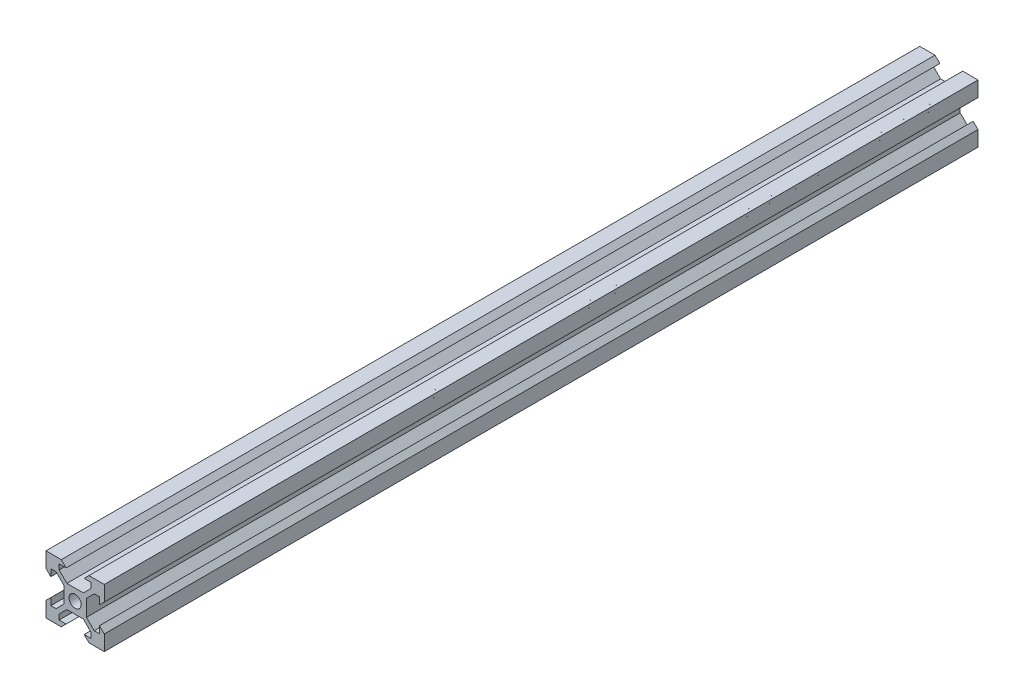
from build123d import *

# Parameters (mm, degrees)
SKETCH1_R           = 2.1
BOSS_EXTRUDE1_DEPTH = 300


with BuildPart() as part:
    # Sketch1 → Boss-Extrude1 (new body)
    with BuildSketch(Plane.XY):
        Polygon((2.834320347, 3.893970342), (5.5, 6.558849663), (5.5, 8.349069506), (3.1, 8.349069506), (4.75, 9.998574117), (10, 9.998574117), (10, 4.746997406), (8.35, 3.097492795), (8.350720674, 5.497492687), (6.560500912, 5.498030255), (3.894821259, 2.833150935), (3.894821259, -2.833150935), (6.560500912, -5.498030255), (8.350720674, -5.497492687), (8.35, -3.097492795), (10, -4.746997406), (10, -9.998574117), (4.75, -9.998574117), (3.1, -8.349069506), (5.5, -8.349069506), (5.5, -6.558849663), (2.834320347, -3.893970342), (-2.834320347, -3.893970342), (-5.5, -6.558849663), (-5.5, -8.349069506), (-3.1, -8.349069506), (-4.75, -9.998574117), (-10, -9.998574117), (-10, -4.746997406), (-8.35, -3.097492795), (-8.350720674, -5.497492687), (-6.560500912, -5.498030255), (-3.894821259, -2.833150935), (-3.894821259, 2.833150935), (-6.560500912, 5.498030255), (-8.350720674, 5.497492687), (-8.35, 3.097492795), (-10, 4.746997406), (-10, 9.998574117), (-4.75, 9.998574117), (-3.1, 8.349069506), (-5.5, 8.349069506), (-5.5, 6.558849663), (-2.834320347, 3.893970342), align=None)
        Circle(SKETCH1_R, mode=Mode.SUBTRACT)
    extrude(amount=BOSS_EXTRUDE1_DEPTH)


solid = part.part
